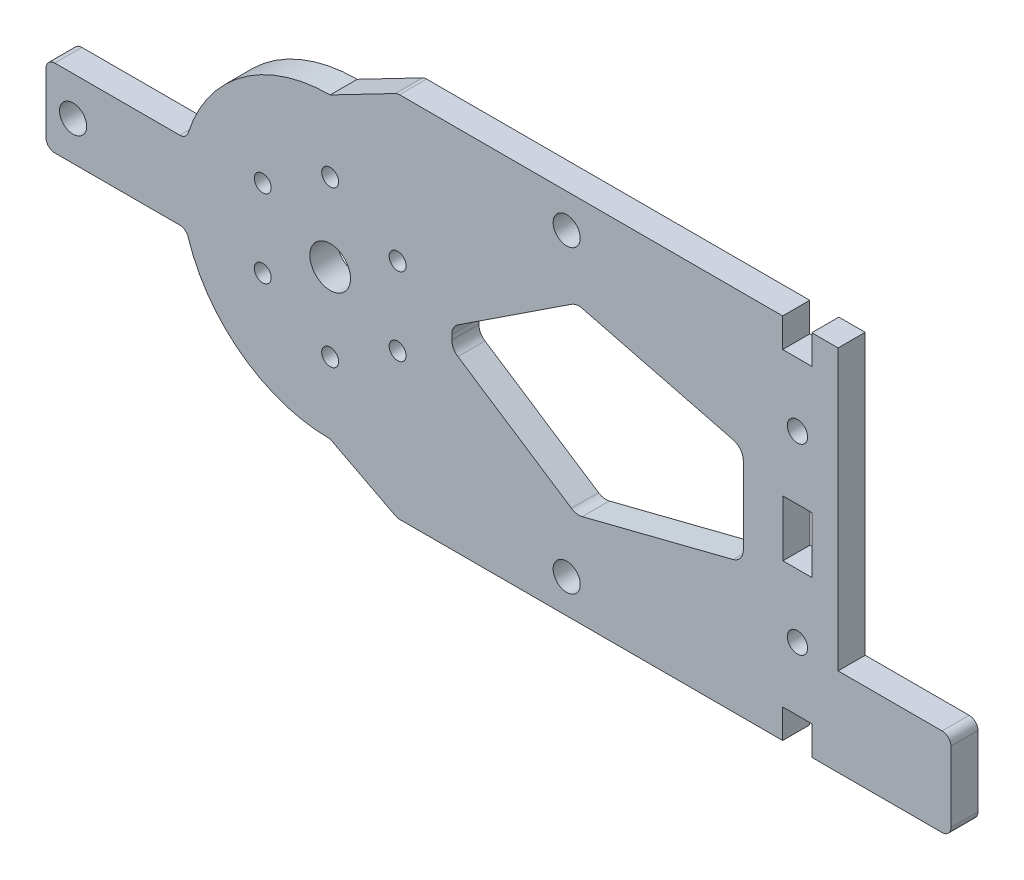
from build123d import *

# Parameters (mm, degrees)
SKETCH_1_R      = 1.5
SKETCH_1_R_2    = 3
SKETCH_1_R_3    = 1.25
SKETCH_1_R_4    = 2
SKETCH_1_W      = 4.3
SKETCH_1_H      = 8.3
EXTRUDE_1_DEPTH = 4
FILLET_1_R      = 1.3
FILLET_2_R      = 2


with BuildPart() as part:
    # 草图1 → 凸台-拉伸1 (new body)
    with BuildSketch(Plane.XY):
        with BuildLine():
            Line((32.115707856, 27.15), (32.115707856, 22.85))
            Line((32.115707856, 22.85), (27.815707856, 22.85))
            Line((27.815707856, 22.85), (27.815707856, 27.15))
            Line((27.815707856, 27.15), (-29.075, 27.15))
            Line((-29.075, 27.15), (-38.998995168, 22.002009663))
            ThreePointArc((-38.998995168, 22.002009663), (-52.370174504, 17.472835843), (-60.236366221, 5.75))
            Line((-60.236366221, 5.75), (-80.958287312, 5.75))
            Line((-80.958287312, 5.75), (-80.958287312, -5.75))
            Line((-80.958287312, -5.75), (-60.236366221, -5.75))
            ThreePointArc((-60.236366221, -5.75), (-52.370174504, -17.472835843), (-38.998995168, -22.002009663))
            Line((-38.998995168, -22.002009663), (-29.075, -27.15))
            Line((-29.075, -27.15), (27.815707856, -27.15))
            Line((27.815707856, -27.15), (27.815707856, -22.85))
            Line((27.815707856, -22.85), (32.115707856, -22.85))
            Line((32.115707856, -22.85), (32.115707856, -27.15))
            Line((32.115707856, -27.15), (36.001004832, -27.15))
            Line((36.001004832, -27.15), (52.659242152, -27.15))
            Line((52.659242152, -27.15), (52.659242152, -14.15))
            Line((52.659242152, -14.15), (36.001004832, -14.15))
            Line((36.001004832, -14.15), (36.001004832, 27.15))
            Line((36.001004832, 27.15), (32.115707856, 27.15))
        make_face()
        with Locations((30.001004832, 13.5)):
            Circle(SKETCH_1_R, mode=Mode.SUBTRACT)
        with Locations(Location((30.001004832, -13.5, 0), (0, 0, 180))):
            Circle(SKETCH_1_R, mode=Mode.SUBTRACT)
        with Locations((-38.998995168, 0)):
            Circle(SKETCH_1_R_2, mode=Mode.SUBTRACT)
        with Locations((-38.998995168, -11.5)):
            Circle(SKETCH_1_R_3, mode=Mode.SUBTRACT)
        with Locations((-48.958287312, -5.75)):
            Circle(SKETCH_1_R_3, mode=Mode.SUBTRACT)
        with Locations((-48.958287312, 5.75)):
            Circle(SKETCH_1_R_3, mode=Mode.SUBTRACT)
        with Locations((-38.998995168, 11.5)):
            Circle(SKETCH_1_R_3, mode=Mode.SUBTRACT)
        with Locations((-29.039703025, 5.75)):
            Circle(SKETCH_1_R_3, mode=Mode.SUBTRACT)
        with Locations((-29.039703025, -5.75)):
            Circle(SKETCH_1_R_3, mode=Mode.SUBTRACT)
        with Locations((-4.075, -22.15)):
            Circle(SKETCH_1_R_4, mode=Mode.SUBTRACT)
        with Locations((-4.075, 22.15)):
            Circle(SKETCH_1_R_4, mode=Mode.SUBTRACT)
        with Locations((-76.958287312, 0)):
            Circle(SKETCH_1_R_4, mode=Mode.SUBTRACT)
        with Locations((30.001004832, 0)):
            Rectangle(SKETCH_1_W, SKETCH_1_H, mode=Mode.SUBTRACT)
        Polygon((-21.039703025, -1.433615613), (-2.627787708, -13.528909152), (22.001004832, -7.277030256), (22.001004832, 7.277030256), (-2.627787708, 13.528909152), (-21.039703025, 1.433615613), align=None, mode=Mode.SUBTRACT)
    extrude(amount=EXTRUDE_1_DEPTH)

    # 圆角1
    fillet_1_edges = [part.edges().sort_by_distance(p)[0] for p in [
        (-29.075, -27.15, 2),
        (-60.236366221, -5.75, 2),
        (-80.958287312, -5.75, 2),
        (-80.958287312, 5.75, 2),
        (-60.236366221, 5.75, 2),
        (-29.075, 27.15, 2),
        (52.659242152, -14.15, 2),
        (52.659242152, -27.15, 2),
    ]]
    fillet(fillet_1_edges, radius=FILLET_1_R)

    # 圆角2
    fillet_2_edges = [part.edges().sort_by_distance(p)[0] for p in [
        (-21.039703025, 1.433615613, 2),
        (-21.039703025, -1.433615613, 2),
        (-2.627787708, -13.528909152, 2),
        (22.001004832, -7.277030256, 2),
        (22.001004832, 7.277030256, 2),
        (-2.627787708, 13.528909152, 2),
    ]]
    fillet(fillet_2_edges, radius=FILLET_2_R)


solid = part.part
